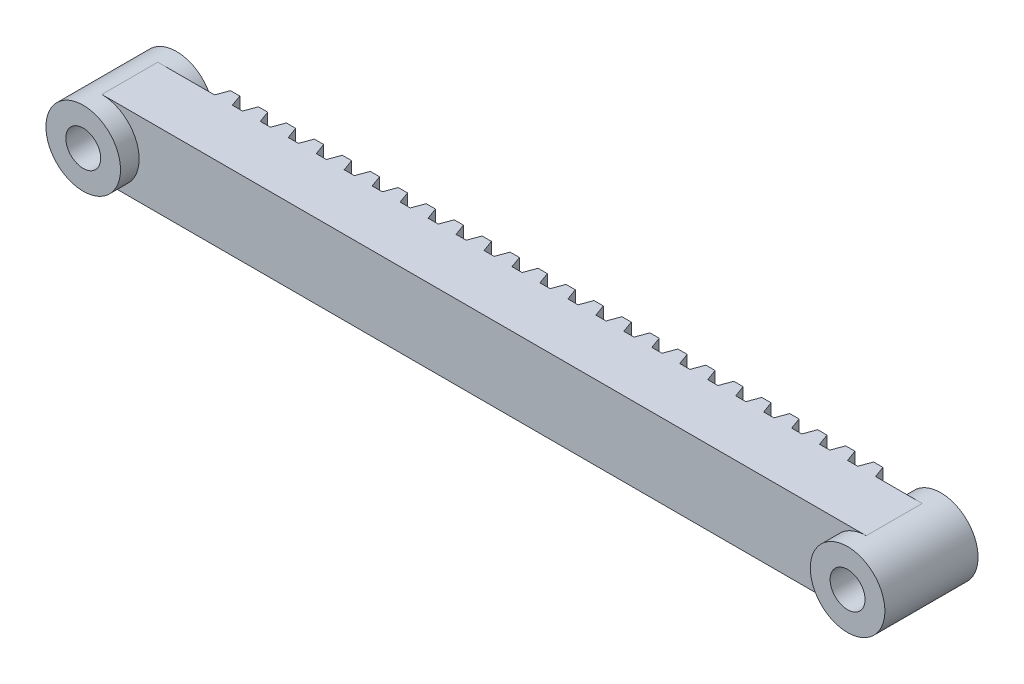
from build123d import *

# Parameters (mm, degrees)
BOSS_EXTRUDE1_DEPTH                  = 10
BOSS_EXTRUDE1_DEPTH_BACK             = 10
SKETCH1_R                            = 8
SKETCH1_R_2                          = 3.75
BOSS_EXTRUDE1_2_DEPTH                = 10
BOSS_EXTRUDE1_2_DEPTH_BACK           = 10
BOSS_EXTRUDE5_REACH                  = 92.907
BOSS_EXTRUDE5_END_RADIUS             = 8
SKETCH2_W                            = 12
SKETCH2_H                            = 16
BOSS_EXTRUDE5_DIRECTION_2_REACH      = 92.907
BOSS_EXTRUDE5_DIRECTION_2_END_RADIUS = 8
BOSS_EXTRUDE6_DEPTH                  = 8
BOSS_EXTRUDE6_DEPTH_BACK             = 8


with BuildPart() as part:
    # Sketch1 → Boss-Extrude1 (new, two sides: drawn at the far end of the back side and taken through both)
    with BuildSketch(Plane.XY.offset(-BOSS_EXTRUDE1_DEPTH_BACK)):
        with Locations((-82, 0)):
            Circle(SKETCH1_R)
        with Locations((-82, 0)):
            Circle(SKETCH1_R_2, mode=Mode.SUBTRACT)
    extrude(amount=BOSS_EXTRUDE1_DEPTH + BOSS_EXTRUDE1_DEPTH_BACK)



with BuildPart() as body_2:
    # Sketch1 → Boss-Extrude1 2 (new, two sides: drawn at the far end of the back side and taken through both)
    with BuildSketch(Plane.XY.offset(-BOSS_EXTRUDE1_2_DEPTH_BACK)):
        with Locations((82, 0)):
            Circle(SKETCH1_R)
        with Locations((82, 0)):
            Circle(SKETCH1_R_2, mode=Mode.SUBTRACT)
    extrude(amount=BOSS_EXTRUDE1_2_DEPTH + BOSS_EXTRUDE1_2_DEPTH_BACK)


with BuildPart() as part_1:
    add(part.part)

    add(body_2.part)  # Boss-Extrude5 merges body 2
    # Boss-Extrude5: up to this cylinder (the profile starts outside it)
    boss_extrude5_end = Plane(origin=(82, 0, 0), z_dir=(0, 0, 1)) * Cylinder(BOSS_EXTRUDE5_END_RADIUS, 202.814, mode=Mode.PRIVATE)
    # Sketch2 → Boss-Extrude5 (add, up to the surface)
    with BuildSketch(Plane(origin=(0, 0, 0), x_dir=(0, 0, -1), z_dir=(1, 0, 0)), mode=Mode.PRIVATE) as boss_extrude5_sk1:
        Rectangle(SKETCH2_W, SKETCH2_H)
    boss_extrude5_tool1 = extrude(boss_extrude5_sk1.sketch, amount=BOSS_EXTRUDE5_REACH, mode=Mode.PRIVATE) - boss_extrude5_end
    add(boss_extrude5_tool1.solids().sort_by_distance((0, 0, 0))[0])

    # Boss-Extrude5 direction 2: up to this cylinder (the profile starts outside it)
    boss_extrude5_direction_2_end = Plane(origin=(-82, 0, 0), z_dir=(0, 0, 1)) * Cylinder(BOSS_EXTRUDE5_DIRECTION_2_END_RADIUS, 202.814, mode=Mode.PRIVATE)
    # Sketch2 → Boss-Extrude5 direction 2 (add, up to the surface)
    with BuildSketch(Plane(origin=(0, 0, 0), x_dir=(0, 0, -1), z_dir=(1, 0, 0)), mode=Mode.PRIVATE) as boss_extrude5_direction_2_sk1:
        Rectangle(SKETCH2_W, SKETCH2_H)
    boss_extrude5_direction_2_tool1 = extrude(boss_extrude5_direction_2_sk1.sketch, amount=-BOSS_EXTRUDE5_DIRECTION_2_REACH, mode=Mode.PRIVATE) - boss_extrude5_direction_2_end
    add(boss_extrude5_direction_2_tool1.solids().sort_by_distance((0, 0, 0))[0])

    # Sketch5 → Boss-Extrude6 (add, two sides: drawn at the far end of the back side and taken through both)
    with BuildSketch(Plane(origin=(0, 0, 0), x_dir=(1, 0, 0), z_dir=(0, 1, 0)).offset(-BOSS_EXTRUDE6_DEPTH_BACK)):
        Polygon((70.090074414, 8.5), (69.090074414, 8.5), (68.180148829, 6), (66, 6), (65.090074414, 8.5), (64.090074414, 8.5), (63.090074414, 8.5), (62.180148829, 6), (60, 6), (59.090074414, 8.5), (58.090074414, 8.5), (57.090074414, 8.5), (56.180148829, 6), (54, 6), (53.090074414, 8.5), (52.090074414, 8.5), (51.090074414, 8.5), (50.180148829, 6), (48, 6), (47.090074414, 8.5), (46.090074414, 8.5), (45.090074414, 8.5), (44.180148829, 6), (42, 6), (41.090074414, 8.5), (40.090074414, 8.5), (39.090074414, 8.5), (38.180148829, 6), (36, 6), (35.090074414, 8.5), (34.090074414, 8.5), (33.090074414, 8.5), (32.180148829, 6), (30, 6), (29.090074414, 8.5), (28.090074414, 8.5), (27.090074414, 8.5), (26.180148829, 6), (24, 6), (23.090074414, 8.5), (22.090074414, 8.5), (21.090074414, 8.5), (20.180148829, 6), (18, 6), (17.090074414, 8.5), (16.090074414, 8.5), (15.090074414, 8.5), (14.180148829, 6), (12, 6), (11.090074414, 8.5), (10.090074414, 8.5), (9.090074414, 8.5), (8.180148829, 6), (6, 6), (5.090074414, 8.5), (4.090074414, 8.5), (3.090074414, 8.5), (2.180148829, 6), (0, 6), (-0.909925586, 8.5), (-1.909925586, 8.5), (-2.909925586, 8.5), (-3.819851171, 6), (-6, 6), (-6.909925586, 8.5), (-7.909925586, 8.5), (-8.909925586, 8.5), (-9.819851171, 6), (-12, 6), (-12.909925586, 8.5), (-13.909925586, 8.5), (-14.909925586, 8.5), (-15.819851171, 6), (-18, 6), (-18.909925586, 8.5), (-19.909925586, 8.5), (-20.909925586, 8.5), (-21.819851171, 6), (-24, 6), (-24.909925586, 8.5), (-25.909925586, 8.5), (-26.909925586, 8.5), (-27.819851171, 6), (-30, 6), (-30.909925586, 8.5), (-31.909925586, 8.5), (-32.909925586, 8.5), (-33.819851171, 6), (-36, 6), (-36.909925586, 8.5), (-37.909925586, 8.5), (-38.909925586, 8.5), (-39.819851171, 6), (-42, 6), (-42.909925586, 8.5), (-43.909925586, 8.5), (-44.909925586, 8.5), (-45.819851171, 6), (-48, 6), (-48.909925586, 8.5), (-49.909925586, 8.5), (-50.909925586, 8.5), (-51.819851171, 6), (-54, 6), (-54.909925586, 8.5), (-55.909925586, 8.5), (-56.909925586, 8.5), (-57.819851171, 6), (-60, 6), (-60.909925586, 8.5), (-61.909925586, 8.5), (-62.909925586, 8.5), (-63.819851171, 6), (-66, 6), (-66.909925586, 8.5), (-67.909925586, 8.5), (-68.909925586, 8.5), (-69.819851171, 6), (-72, 6), (-72, -6), (72, -6), (72, 6), (71.090074414, 8.5), align=None)
    extrude(amount=BOSS_EXTRUDE6_DEPTH + BOSS_EXTRUDE6_DEPTH_BACK)


solid = part_1.part
